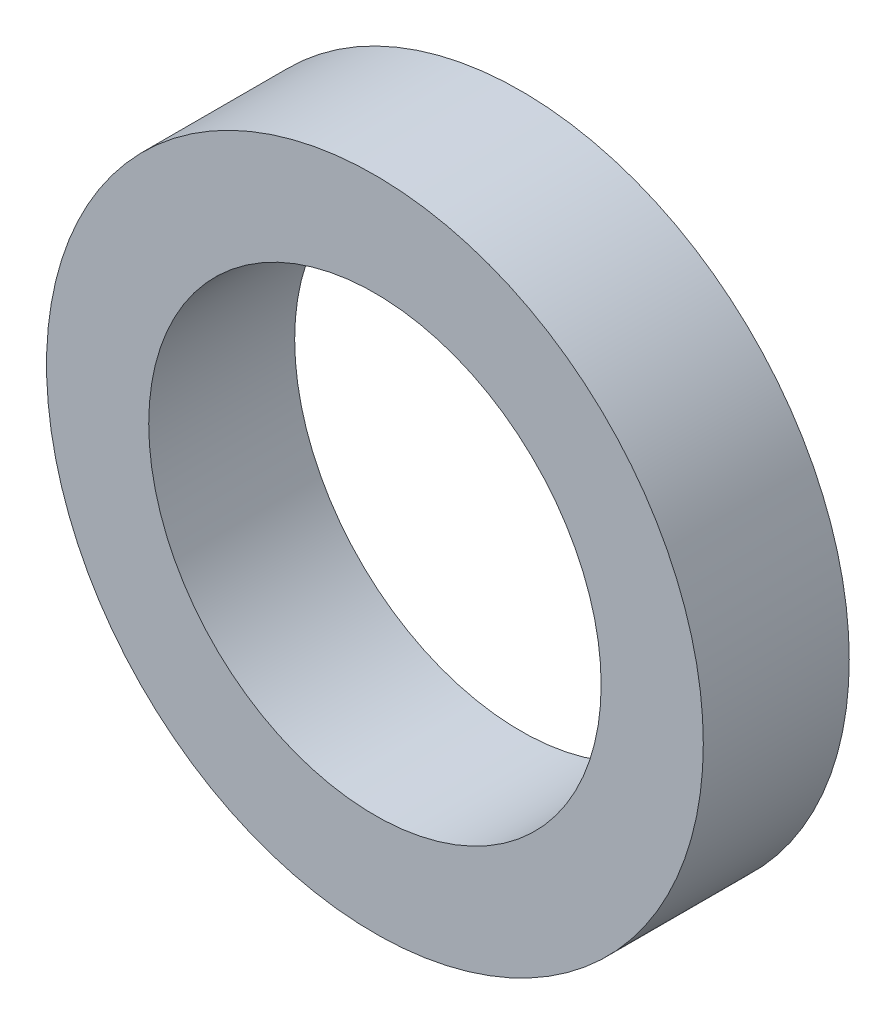
from build123d import *

# Parameters (mm, degrees)
SKETCH_1_R      = 4.5
SKETCH_1_R_2    = 3.1
EXTRUDE_1_DEPTH = 2


with BuildPart() as part:
    # Эскиз1 → Бобышка-Вытянуть1 (new body)
    with BuildSketch(Plane.XY):
        Circle(SKETCH_1_R)
        Circle(SKETCH_1_R_2, mode=Mode.SUBTRACT)
    extrude(amount=EXTRUDE_1_DEPTH)


solid = part.part
